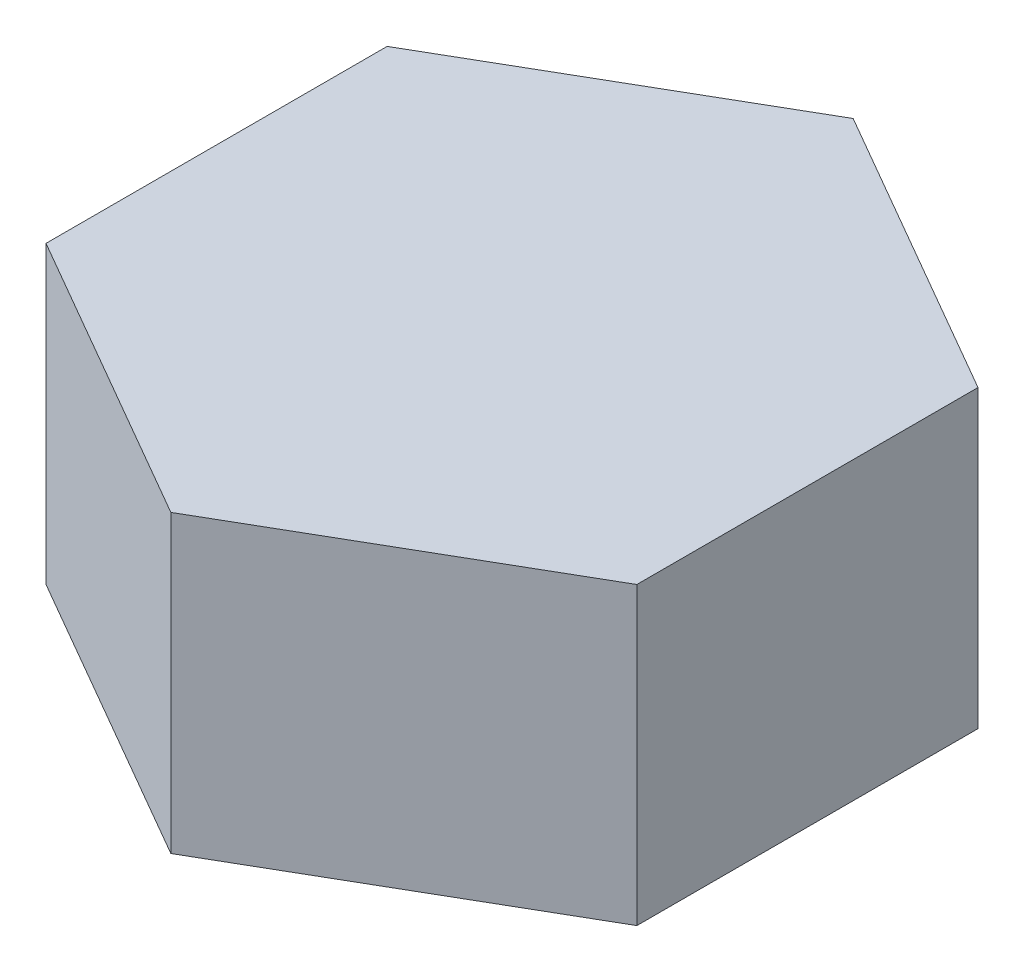
from build123d import *

# Parameters (mm, degrees)
BOSS_EXTRUDE2_DEPTH = 50.8


with BuildPart() as part:
    # Sketch2 → Boss-Extrude2 (new body)
    with BuildSketch(Plane(origin=(0, 0, 0), x_dir=(1, 0, 0), z_dir=(0, 1, 0))):
        Polygon((50.8, 29.329393675), (0, 58.65878735), (-50.8, 29.329393675), (-50.8, -29.329393675), (0, -58.65878735), (50.8, -29.329393675), align=None)
    extrude(amount=BOSS_EXTRUDE2_DEPTH)


solid = part.part
